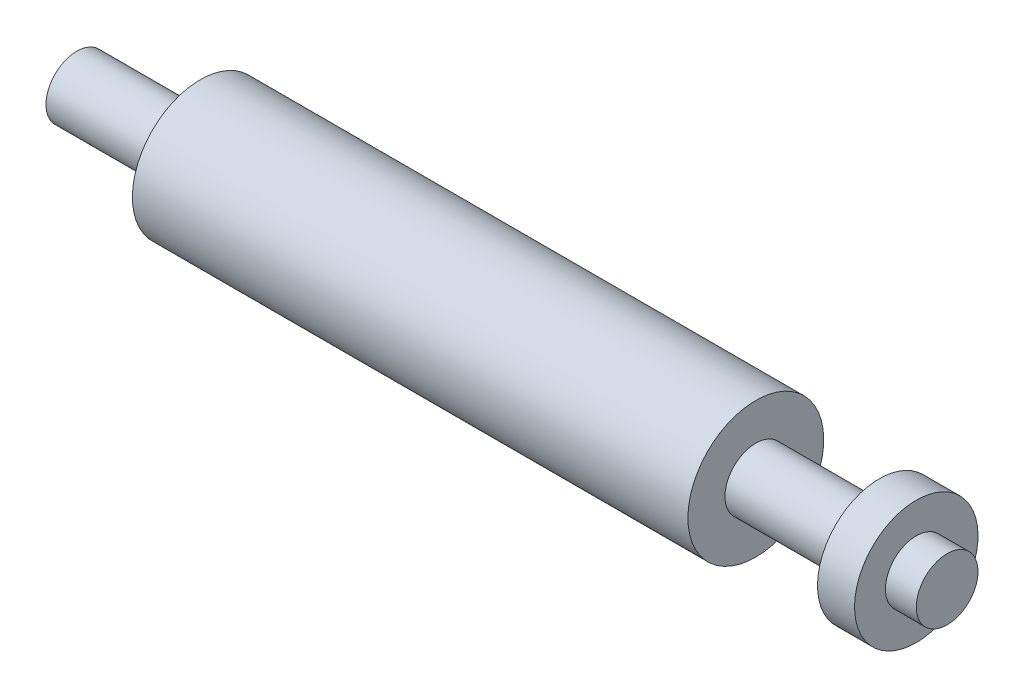
from build123d import *

# Parameters (mm, degrees)
SKETCH1_W = 25
SKETCH1_H = 25


with BuildPart() as part:
    # Sketch1 → Revolve1 (revolve)
    with BuildSketch(Plane.XY, mode=Mode.PRIVATE) as revolve1_sk:
        Polygon((-230.074626866, 25), (-330.074626866, 25), (-330.074626866, 0), (349.925373134, 0), (349.925373134, 50), (319.925373134, 50), (319.925373134, 25), (219.925373134, 25), (219.925373134, 55), (-230.074626866, 55), align=None)
        with Locations((362.425373134, 12.5)):
            Rectangle(SKETCH1_W, SKETCH1_H)
    revolve(revolve1_sk.sketch.rotate(Axis((-330.074626866, 0, 0), (1, 0, 0)), 180), axis=Axis((-330.074626866, 0, 0), (1, 0, 0)))


solid = part.part
